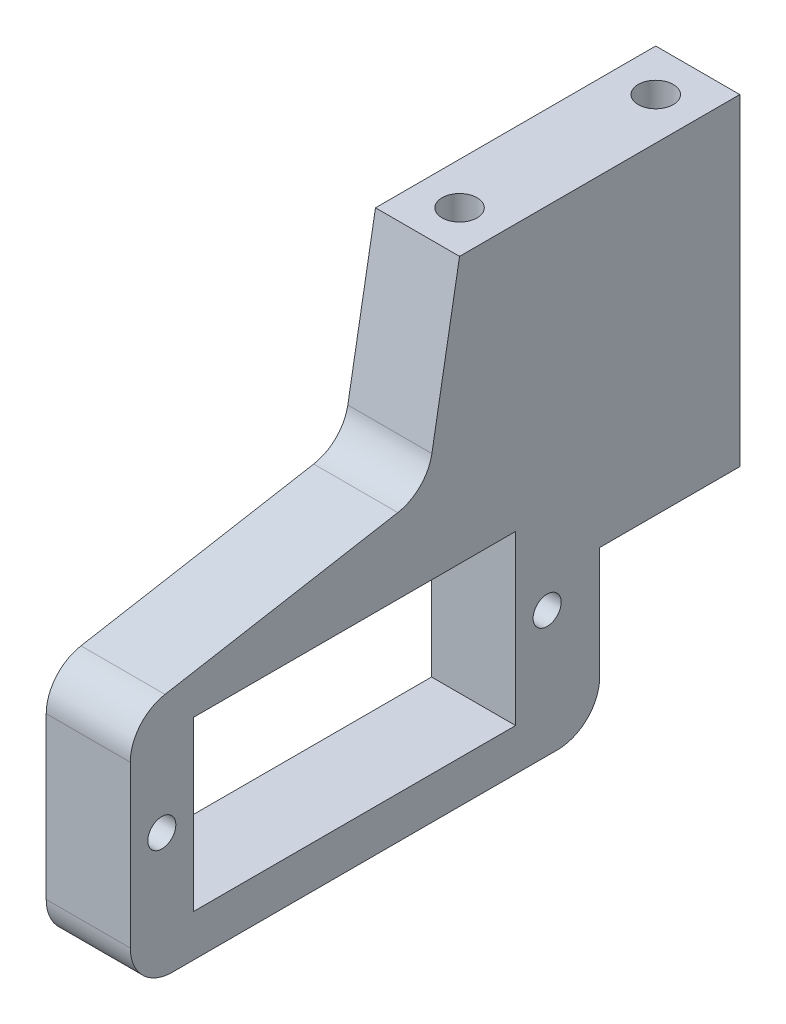
from build123d import *

# Parameters (mm, degrees)
SKETCH2_R                                 = 1
SKETCH2_W                                 = 23
SKETCH2_H                                 = 12
BOSS_EXTRUDE1_DEPTH                       = 6
CUT_EXTRUDE1_REACH                        = 57.536
SKETCH3_W                                 = 10
SKETCH3_H                                 = 11
FILLET1_R                                 = 3
TAP_DRILL_FOR_M3X0_5_TAP1_D               = 2.5
TAP_DRILL_FOR_M3X0_5_TAP1_DEPTH           = 10
TAP_DRILL_FOR_M3X0_5_TAP1_TIP             = 0.751075774
TAP_DRILL_FOR_M3X0_5_TAP1_ON_FACE_2_D     = 2.5
TAP_DRILL_FOR_M3X0_5_TAP1_ON_FACE_2_DEPTH = 10
TAP_DRILL_FOR_M3X0_5_TAP1_ON_FACE_2_TIP   = 0.751075774


with BuildPart() as part:
    # Sketch2 → Boss-Extrude1 (new body)
    with BuildSketch(Plane(origin=(0, 0, 0), x_dir=(0, 0, -1), z_dir=(1, 0, 0))):
        Polygon((-20, 0), (-22.339658165, -13.268860813), (-43.5, -17), (-43.5, -34), (0, -34), (0, 0), align=None)
        with Locations(Location((-41.25, -25, 0), (0, 0, 180))):
            Circle(SKETCH2_R, mode=Mode.SUBTRACT)
        with Locations(Location((-13.75, -25, 0), (0, 0, 180))):
            Circle(SKETCH2_R, mode=Mode.SUBTRACT)
        with Locations((-27.5, -25)):
            Rectangle(SKETCH2_W, SKETCH2_H, mode=Mode.SUBTRACT)
    extrude(amount=BOSS_EXTRUDE1_DEPTH)

    # Sketch3 → Cut-Extrude1 (cut, up to next)
    with BuildSketch(Plane.ZY, mode=Mode.PRIVATE) as cut_extrude1_sk1:
        with Locations((5, -28.5)):
            Rectangle(SKETCH3_W, SKETCH3_H)
    cut_extrude1_tool1 = extrude(cut_extrude1_sk1.sketch, amount=-CUT_EXTRUDE1_REACH, mode=Mode.PRIVATE) & part.part
    add(cut_extrude1_tool1.solids().sort_by_distance((0, -28.5, 5))[0], mode=Mode.SUBTRACT)

    # Fillet1
    fillet1_edges = [part.edges().sort_by_distance(p)[0] for p in [
        (3, -34, 43.5),
        (3, -17, 43.5),
        (3, -13.268860813, 22.339658165),
        (3, -34, 10),
    ]]
    fillet(fillet1_edges, radius=FILLET1_R)

    # Tap Drill for M3x0.5 Tap1
    with Locations(Plane(origin=(3, 0, 3), x_dir=(0, 0, 1), z_dir=(0, 1, 0))):
        with Locations((0, 0), (14, 0)):
            Hole(TAP_DRILL_FOR_M3X0_5_TAP1_D / 2, depth=TAP_DRILL_FOR_M3X0_5_TAP1_DEPTH)
            with Locations((0, 0, -(TAP_DRILL_FOR_M3X0_5_TAP1_DEPTH + TAP_DRILL_FOR_M3X0_5_TAP1_TIP / 2))):  # 118° drill point
                Cone(0, TAP_DRILL_FOR_M3X0_5_TAP1_D / 2, TAP_DRILL_FOR_M3X0_5_TAP1_TIP, mode=Mode.SUBTRACT)

    # Tap Drill for M3x0.5 Tap1 on face 2
    with Locations(Plane(origin=(3, -23, 5), x_dir=(0, 0, -1), z_dir=(0, -1, 0))):
        with Locations((0, 0)):
            Hole(TAP_DRILL_FOR_M3X0_5_TAP1_ON_FACE_2_D / 2, depth=TAP_DRILL_FOR_M3X0_5_TAP1_ON_FACE_2_DEPTH)
            with Locations((0, 0, -(TAP_DRILL_FOR_M3X0_5_TAP1_ON_FACE_2_DEPTH + TAP_DRILL_FOR_M3X0_5_TAP1_ON_FACE_2_TIP / 2))):  # 118° drill point
                Cone(0, TAP_DRILL_FOR_M3X0_5_TAP1_ON_FACE_2_D / 2, TAP_DRILL_FOR_M3X0_5_TAP1_ON_FACE_2_TIP, mode=Mode.SUBTRACT)


solid = part.part
